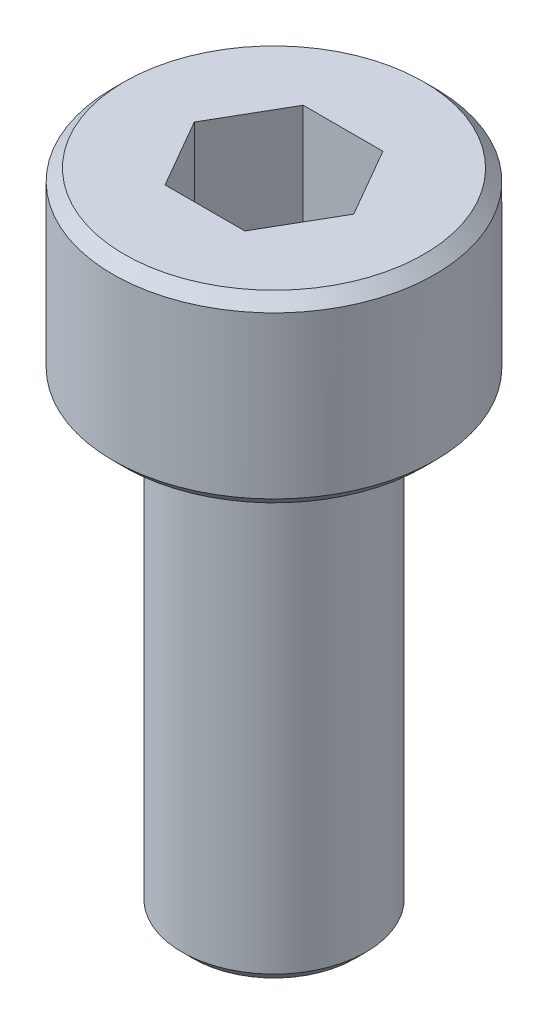
from build123d import *

# Parameters (mm, degrees)
CUT_EXTRUDE1_DEPTH = 3
CHAMFER1_SIZE      = 0.25


with BuildPart() as part:
    # Sketch1 → Revolve1 (revolve)
    with BuildSketch(Plane.XY):
        Polygon((0, 4), (-3.5, 4), (-3.5, 0), (-2, 0), (-2, -10), (0, -10), (0, 0), align=None)
    revolve(axis=Axis((0, -10, 0), (0, -1, 0)))

    # Sketch2 → Cut-Extrude1 (cut)
    with BuildSketch(Plane(origin=(0, 4, 0), x_dir=(1, 0, 0), z_dir=(0, 1, 0))):
        Polygon((0.866025404, 1.5), (-0.866025404, 1.5), (-1.732050808, 0), (-0.866025404, -1.5), (0.866025404, -1.5), (1.732050808, 0), align=None)
    extrude(amount=-CUT_EXTRUDE1_DEPTH, mode=Mode.SUBTRACT)

    # Chamfer1
    chamfer1_edges = [part.edges().sort_by_distance(p)[0] for p in [
        (2, -10, 0),
        (3.5, 0, 0),
        (3.5, 4, 0),
    ]]
    chamfer(chamfer1_edges, length=CHAMFER1_SIZE)


solid = part.part
